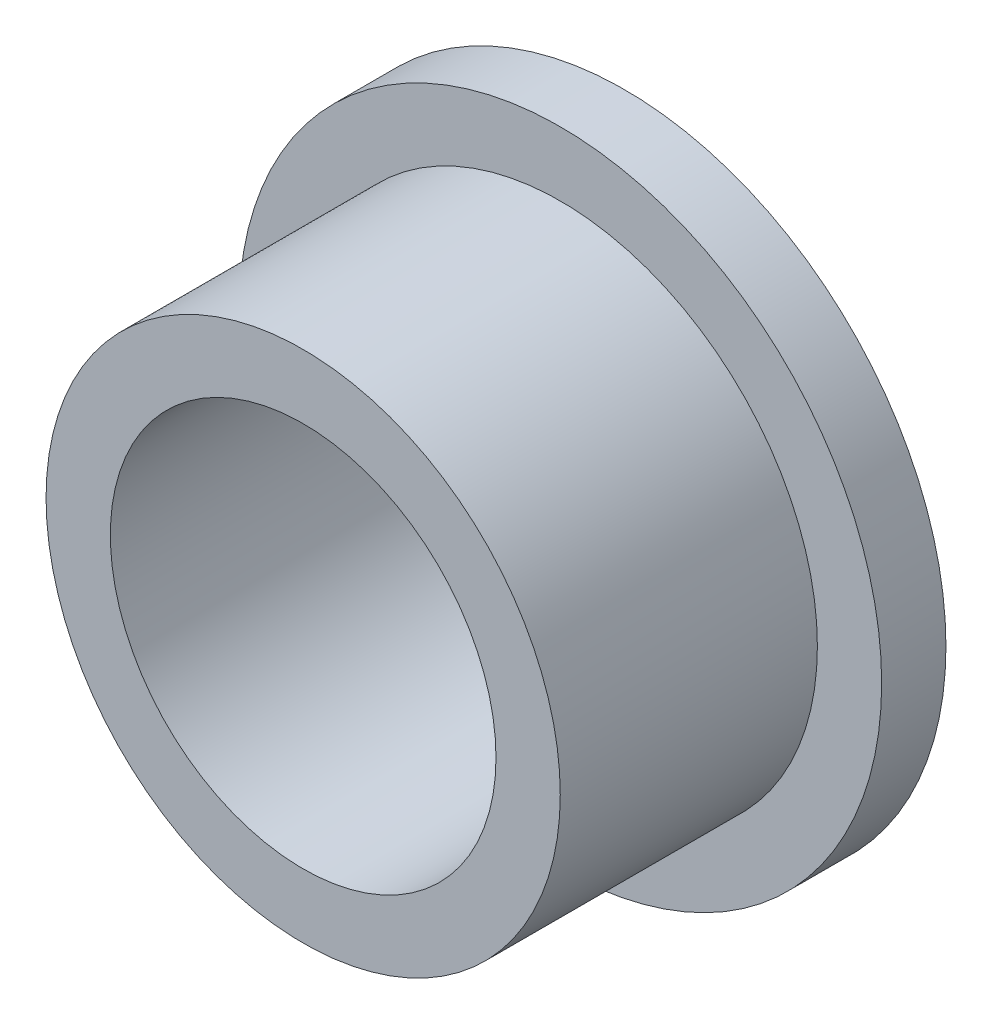
from build123d import *

# Parameters (mm, degrees)
SKETCH_1_R      = 5
SKETCH_1_R_2    = 3
EXTRUDE_1_DEPTH = 1
SKETCH_2_R      = 4
SKETCH_2_R_2    = 3
EXTRUDE_2_DEPTH = 5


with BuildPart() as part:
    # ｽｹｯﾁ1 → ﾎﾞｽ - 押し出し1 (new body)
    with BuildSketch(Plane.XY):
        Circle(SKETCH_1_R)
        Circle(SKETCH_1_R_2, mode=Mode.SUBTRACT)
    extrude(amount=EXTRUDE_1_DEPTH)

    # ｽｹｯﾁ2 → ﾎﾞｽ - 押し出し2 (add)
    with BuildSketch(Plane.XY):
        Circle(SKETCH_2_R)
        Circle(SKETCH_2_R_2, mode=Mode.SUBTRACT)
    extrude(amount=EXTRUDE_2_DEPTH)


solid = part.part
